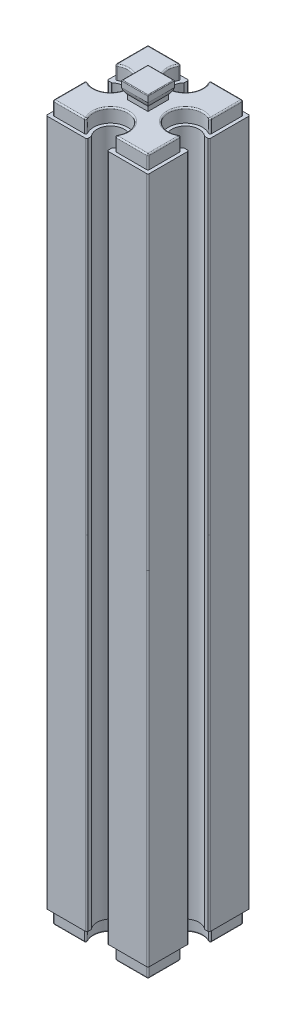
from build123d import *

# Parameters (mm, degrees)
EXTRUDE_1_DEPTH        = 50.5
EXTRUDE_2_DEPTH        = 2
EXTRUDE_3_DEPTH        = 2
FILLET_3_R             = 0.2
CUT_EXTRUDE_1_DEPTH    = 3
FILLET_4_R             = 0.2
FILLET_5_R             = 0.1
FILLET_3_OF_MIRROR_1_R = 0.2
FILLET_4_OF_MIRROR_1_R = 0.2
FILLET_5_OF_MIRROR_1_R = 0.1


with BuildPart() as part:
    # 草图1 → 凸台-拉伸1 (new body)
    with BuildSketch(Plane(origin=(0, 0, 0), x_dir=(1, 0, 0), z_dir=(0, 1, 0))):
        with BuildLine():
            Line((-7.5, 7.5), (-1.5, 7.5))
            Line((-1.5, 7.5), (-1.5, 6.822875656))
            ThreePointArc((-1.5, 6.822875656), (0, 3.5), (1.5, 6.822875656))
            Line((1.5, 6.822875656), (1.5, 7.5))
            Line((1.5, 7.5), (7.5, 7.5))
            Line((7.5, 7.5), (7.5, 1.5))
            Line((7.5, 1.5), (6.822875656, 1.5))
            ThreePointArc((6.822875656, 1.5), (3.5, 0), (6.822875656, -1.5))
            Line((6.822875656, -1.5), (7.5, -1.5))
            Line((7.5, -1.5), (7.5, -7.5))
            Line((7.5, -7.5), (1.5, -7.5))
            Line((1.5, -7.5), (1.5, -6.822875656))
            ThreePointArc((1.5, -6.822875656), (0, -3.5), (-1.5, -6.822875656))
            Line((-1.5, -6.822875656), (-1.5, -7.5))
            Line((-1.5, -7.5), (-7.5, -7.5))
            Line((-7.5, -7.5), (-7.5, -1.5))
            Line((-7.5, -1.5), (-6.822875656, -1.5))
            ThreePointArc((-6.822875656, -1.5), (-3.5, 0), (-6.822875656, 1.5))
            Line((-6.822875656, 1.5), (-7.5, 1.5))
            Line((-7.5, 1.5), (-7.5, 7.5))
        make_face()
    extrude_1 = extrude(amount=EXTRUDE_1_DEPTH)

    # 草图2 → 凸台-拉伸2 (add)
    with BuildSketch(Plane(origin=(0, 50.5, 0), x_dir=(1, 0, 0), z_dir=(0, 1, 0))):
        with BuildLine():
            Line((-7, 7), (-7, 2))
            ThreePointArc((-7, 2), (-3, 0), (-7, -2))
            Line((-7, -2), (-7, -7))
            Line((-7, -7), (-2, -7))
            ThreePointArc((-2, -7), (0, -3), (2, -7))
            Line((2, -7), (7, -7))
            Line((7, -7), (7, -2))
            ThreePointArc((7, -2), (3, 0), (7, 2))
            Line((7, 2), (7, 7))
            Line((7, 7), (2, 7))
            ThreePointArc((2, 7), (0, 3), (-2, 7))
            Line((-2, 7), (-7, 7))
        make_face()
    extrude_2 = extrude(amount=EXTRUDE_2_DEPTH)

    # 草图3 → 凸台-拉伸3 (add, symmetric)
    with BuildSketch(Plane(origin=(0, 0, 0), x_dir=(0, 0, -1), z_dir=(1, 0, 0))):
        with BuildLine():
            Line((-1.5, 52.5), (1.5, 52.5))
            Line((1.5, 52.5), (1.5, 53.177124344))
            ThreePointArc((1.5, 53.177124344), (1.780042303, 53.588161527), (1.95, 54.055590279))
            Line((1.95, 54.055590279), (1.95, 55))
            Line((1.95, 55), (-1.95, 55))
            Line((-1.95, 55), (-1.95, 54.055590279))
            ThreePointArc((-1.95, 54.055590279), (-1.780042303, 53.588161527), (-1.5, 53.177124344))
            Line((-1.5, 53.177124344), (-1.5, 52.5))
        make_face()
    extrude_3 = extrude(amount=EXTRUDE_3_DEPTH, both=True)

    # 圆角3
    fillet_3_edges = [part.edges().sort_by_distance(p)[0] for p in [
        (-7.5, 25.25, -7.5),
        (-1.5, 25.25, -7.5),
        (1.5, 25.25, -7.5),
        (7.5, 25.25, -7.5),
        (7.5, 25.25, -1.5),
        (7.5, 25.25, 1.5),
        (7.5, 25.25, 7.5),
        (1.5, 25.25, 7.5),
        (-1.5, 25.25, 7.5),
        (-7.5, 25.25, 7.5),
        (-7.5, 25.25, 1.5),
        (-6.822875656, 25.25, -1.5),
        (-7.5, 25.25, -1.5),
    ]]
    fillet(fillet_3_edges, radius=FILLET_3_R)

    # 草图4 → 切除-拉伸1 (cut, symmetric)
    with BuildSketch(Plane.XY):
        with BuildLine():
            Line((1.95, 55), (2, 55))
            Line((2, 55), (2, 52.5))
            Line((2, 52.5), (1.5, 52.5))
            Line((1.5, 52.5), (1.5, 53.177124344))
            ThreePointArc((1.5, 53.177124344), (1.780042303, 53.588161527), (1.95, 54.055590279))
            Line((1.95, 54.055590279), (1.95, 55))
        make_face()
        with BuildLine():
            Line((-1.95, 55), (-1.95, 54.055590279))
            ThreePointArc((-1.95, 54.055590279), (-1.780042303, 53.588161527), (-1.5, 53.177124344))
            Line((-1.5, 53.177124344), (-1.5, 52.5))
            Line((-1.5, 52.5), (-2, 52.5))
            Line((-2, 52.5), (-2, 55))
            Line((-2, 55), (-1.95, 55))
        make_face()
    cut_extrude_1 = extrude(amount=CUT_EXTRUDE_1_DEPTH, both=True, mode=Mode.SUBTRACT)

    # 圆角4
    fillet_4_edges = [part.edges().sort_by_distance(p)[0] for p in [
        (-2, 51.5, -7),
        (-7, 51.5, -7),
        (-7, 51.5, -2),
        (-7, 51.5, 2),
        (-7, 51.5, 7),
        (-2, 51.5, 7),
        (2, 51.5, 7),
        (7, 51.5, 7),
        (7, 51.5, 2),
        (7, 51.5, -2),
        (7, 51.5, -7),
        (2, 51.5, -7),
        (-4.5, 52.5, -7),
        (-7, 52.5, -4.5),
        (-3, 52.5, 0),
        (-7, 52.5, 4.5),
        (-4.5, 52.5, 7),
        (0, 52.5, 3),
        (4.5, 52.5, 7),
        (7, 52.5, 4.5),
        (3, 52.5, 0),
        (7, 52.5, -4.5),
        (4.5, 52.5, -7),
        (0, 52.5, -3),
    ]]
    fillet(fillet_4_edges, radius=FILLET_4_R)

    # 圆角5
    fillet_5_edges = [part.edges().sort_by_distance(p)[0] for p in [
        (1.95, 55, 0),
        (0, 55, -1.95),
        (0, 55, 1.95),
        (-1.95, 55, 0),
    ]]
    fillet(fillet_5_edges, radius=FILLET_5_R)


with BuildPart() as mirror_1_1:
    # 镜向1: 凸台-拉伸1, 凸台-拉伸2, 凸台-拉伸3 across Top Plane
    add(extrude_1.mirror(Plane(origin=(0, 0, 0), x_dir=(1, 0, 0), z_dir=(0, 1, 0))))
    add(extrude_2.mirror(Plane(origin=(0, 0, 0), x_dir=(1, 0, 0), z_dir=(0, 1, 0))))
    add(extrude_3.mirror(Plane(origin=(0, 0, 0), x_dir=(1, 0, 0), z_dir=(0, 1, 0))))

    # Mirror 1 2: 切除-拉伸1 across Top Plane
    add(cut_extrude_1.mirror(Plane(origin=(0, 0, 0), x_dir=(1, 0, 0), z_dir=(0, 1, 0))), mode=Mode.SUBTRACT)

    # 圆角3 of 镜向1
    fillet_3_of_mirror_1_edges = [mirror_1_1.edges().sort_by_distance(p)[0] for p in [
        (-7.5, -25.25, -7.5),
        (-1.5, -25.25, -7.5),
        (1.5, -25.25, -7.5),
        (7.5, -25.25, -7.5),
        (7.5, -25.25, -1.5),
        (7.5, -25.25, 1.5),
        (7.5, -25.25, 7.5),
        (1.5, -25.25, 7.5),
        (-1.5, -25.25, 7.5),
        (-7.5, -25.25, 7.5),
        (-7.5, -25.25, 1.5),
        (-6.822875656, -25.25, -1.5),
        (-7.5, -25.25, -1.5),
    ]]
    fillet(fillet_3_of_mirror_1_edges, radius=FILLET_3_OF_MIRROR_1_R)

    # 圆角4 of 镜向1
    fillet_4_of_mirror_1_edges = [mirror_1_1.edges().sort_by_distance(p)[0] for p in [
        (-2, -51.5, -7),
        (-7, -51.5, -7),
        (-7, -51.5, -2),
        (-7, -51.5, 2),
        (-7, -51.5, 7),
        (-2, -51.5, 7),
        (2, -51.5, 7),
        (7, -51.5, 7),
        (7, -51.5, 2),
        (7, -51.5, -2),
        (7, -51.5, -7),
        (2, -51.5, -7),
        (-4.5, -52.5, -7),
        (-7, -52.5, -4.5),
        (-3, -52.5, 0),
        (-7, -52.5, 4.5),
        (-4.5, -52.5, 7),
        (0, -52.5, 3),
        (4.5, -52.5, 7),
        (7, -52.5, 4.5),
        (3, -52.5, 0),
        (7, -52.5, -4.5),
        (4.5, -52.5, -7),
        (0, -52.5, -3),
    ]]
    fillet(fillet_4_of_mirror_1_edges, radius=FILLET_4_OF_MIRROR_1_R)

    # 圆角5 of 镜向1
    fillet_5_of_mirror_1_edges = [mirror_1_1.edges().sort_by_distance(p)[0] for p in [
        (1.95, -55, 0),
        (0, -55, -1.95),
        (0, -55, 1.95),
        (-1.95, -55, 0),
    ]]
    fillet(fillet_5_of_mirror_1_edges, radius=FILLET_5_OF_MIRROR_1_R)


with BuildPart() as part_1:
    add(part.part)

    # 镜向1 united with what the copies tou: union 镜向1_1
    add(mirror_1_1.part)


solid = part_1.part
